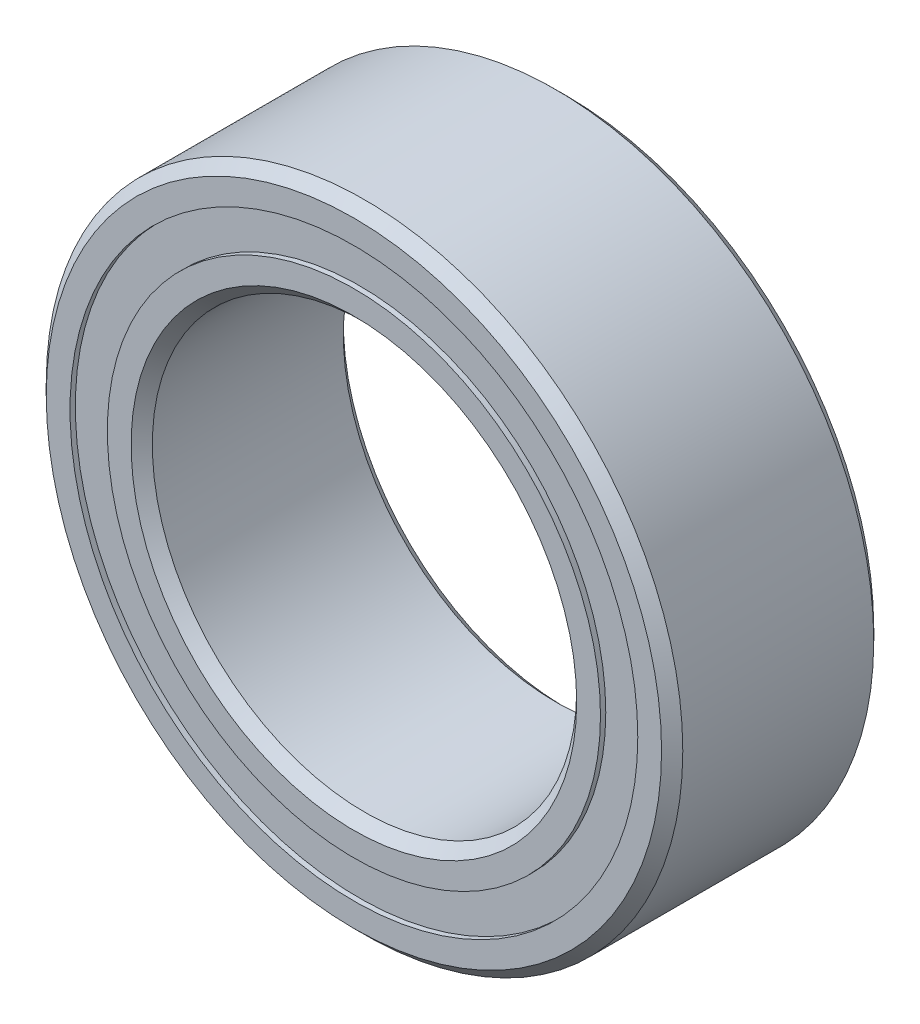
from build123d import *

# Parameters (mm, degrees)
CIRPATTERN1_COUNT = 12
SKETCH5_W         = 0.749364756
SKETCH5_H         = 0.558241758


with BuildPart() as part:
    # Sketch1 → Revolve1 (revolve)
    with BuildSketch(Plane(origin=(0, 0, 0), x_dir=(0, 0, -1), z_dir=(1, 0, 0)), mode=Mode.PRIVATE) as revolve1_sk:
        with BuildLine():
            Line((1.42875, 4.7625), (-1.42875, 4.7625))
            Line((-1.42875, 4.7625), (-1.5875, 4.60375))
            Line((-1.5875, 4.60375), (-1.5875, 4.247870879))
            Line((-1.5875, 4.247870879), (-0.705555556, 4.247870879))
            ThreePointArc((-0.705555556, 4.247870879), (0, 4.727510244), (0.705555556, 4.247870879))
            Line((0.705555556, 4.247870879), (1.5875, 4.247870879))
            Line((1.5875, 4.247870879), (1.5875, 4.60375))
            Line((1.5875, 4.60375), (1.42875, 4.7625))
        make_face()
    revolve(revolve1_sk.sketch.rotate(Axis((0, 0, 1.5875), (0, 0, -1)), 90), axis=Axis((0, 0, 1.5875), (0, 0, -1)))


with BuildPart() as body_2:
    # Sketch3 → Revolve3 (revolve)
    with BuildSketch(Plane(origin=(0, 0, 0), x_dir=(0, 0, -1), z_dir=(1, 0, 0)), mode=Mode.PRIVATE) as revolve3_sk:
        with BuildLine():
            Line((-0.705555556, 3.689629121), (-1.5875, 3.689629121))
            Line((-1.5875, 3.689629121), (-1.5875, 3.33375))
            Line((-1.5875, 3.33375), (-1.42875, 3.175))
            Line((-1.42875, 3.175), (1.42875, 3.175))
            Line((1.42875, 3.175), (1.5875, 3.33375))
            Line((1.5875, 3.33375), (1.5875, 3.689629121))
            Line((1.5875, 3.689629121), (0.705555556, 3.689629121))
            ThreePointArc((0.705555556, 3.689629121), (0, 3.209989756), (-0.705555556, 3.689629121))
        make_face()
    revolve(revolve3_sk.sketch.rotate(Axis((0, 0, 1.5875), (0, 0, -1)), 90), axis=Axis((0, 0, 1.5875), (0, 0, -1)))


with BuildPart() as body_3:
    # Sketch4 → Revolve4 (revolve)
    with BuildSketch(Plane(origin=(0, 0, 0), x_dir=(0, 0, -1), z_dir=(1, 0, 0))):
        with BuildLine():
            Line((-0.758760244, 3.96875), (0.758760244, 3.96875))
            ThreePointArc((0.758760244, 3.96875), (0, 4.727510244), (-0.758760244, 3.96875))
        make_face()
    revolve(axis=Axis((0, 3.96875, 0.758760244), (0, 0, -1)))


with BuildPart() as cirpattern1_1:
    # CirPattern1: pattern copy
    add(body_3.part.rotate(Axis((0, 0, 0), (0, 0, 1)), 1 * 360 / CIRPATTERN1_COUNT))


with BuildPart() as cirpattern1_2:
    # CirPattern1: pattern copy
    add(body_3.part.rotate(Axis((0, 0, 0), (0, 0, 1)), 2 * 360 / CIRPATTERN1_COUNT))


with BuildPart() as cirpattern1_3:
    # CirPattern1: pattern copy
    add(body_3.part.rotate(Axis((0, 0, 0), (0, 0, 1)), 3 * 360 / CIRPATTERN1_COUNT))


with BuildPart() as cirpattern1_4:
    # CirPattern1: pattern copy
    add(body_3.part.rotate(Axis((0, 0, 0), (0, 0, 1)), 4 * 360 / CIRPATTERN1_COUNT))


with BuildPart() as cirpattern1_5:
    # CirPattern1: pattern copy
    add(body_3.part.rotate(Axis((0, 0, 0), (0, 0, 1)), 5 * 360 / CIRPATTERN1_COUNT))


with BuildPart() as cirpattern1_6:
    # CirPattern1: pattern copy
    add(body_3.part.rotate(Axis((0, 0, 0), (0, 0, 1)), 6 * 360 / CIRPATTERN1_COUNT))


with BuildPart() as cirpattern1_7:
    # CirPattern1: pattern copy
    add(body_3.part.rotate(Axis((0, 0, 0), (0, 0, 1)), 7 * 360 / CIRPATTERN1_COUNT))


with BuildPart() as cirpattern1_8:
    # CirPattern1: pattern copy
    add(body_3.part.rotate(Axis((0, 0, 0), (0, 0, 1)), 8 * 360 / CIRPATTERN1_COUNT))


with BuildPart() as cirpattern1_9:
    # CirPattern1: pattern copy
    add(body_3.part.rotate(Axis((0, 0, 0), (0, 0, 1)), 9 * 360 / CIRPATTERN1_COUNT))


with BuildPart() as cirpattern1_10:
    # CirPattern1: pattern copy
    add(body_3.part.rotate(Axis((0, 0, 0), (0, 0, 1)), 10 * 360 / CIRPATTERN1_COUNT))


with BuildPart() as cirpattern1_11:
    # CirPattern1: pattern copy
    add(body_3.part.rotate(Axis((0, 0, 0), (0, 0, 1)), 11 * 360 / CIRPATTERN1_COUNT))


with BuildPart() as body_15:
    # Sketch5 → Revolve5 (revolve)
    with BuildSketch(Plane(origin=(0, 0, 0), x_dir=(0, 0, -1), z_dir=(1, 0, 0)), mode=Mode.PRIVATE) as revolve5_sk:
        with Locations((-1.133442622, 3.96875)):
            Rectangle(SKETCH5_W, SKETCH5_H)
        with Locations((1.133442622, 3.96875)):
            Rectangle(SKETCH5_W, SKETCH5_H)
    revolve(revolve5_sk.sketch.rotate(Axis((0, 0, 1.5875), (0, 0, -1)), 90), axis=Axis((0, 0, 1.5875), (0, 0, -1)))


solid = Compound([part.part, body_2.part, body_3.part, cirpattern1_1.part, cirpattern1_2.part, cirpattern1_3.part, cirpattern1_4.part, cirpattern1_5.part, cirpattern1_6.part, cirpattern1_7.part, cirpattern1_8.part, cirpattern1_9.part, cirpattern1_10.part, cirpattern1_11.part, body_15.part])
